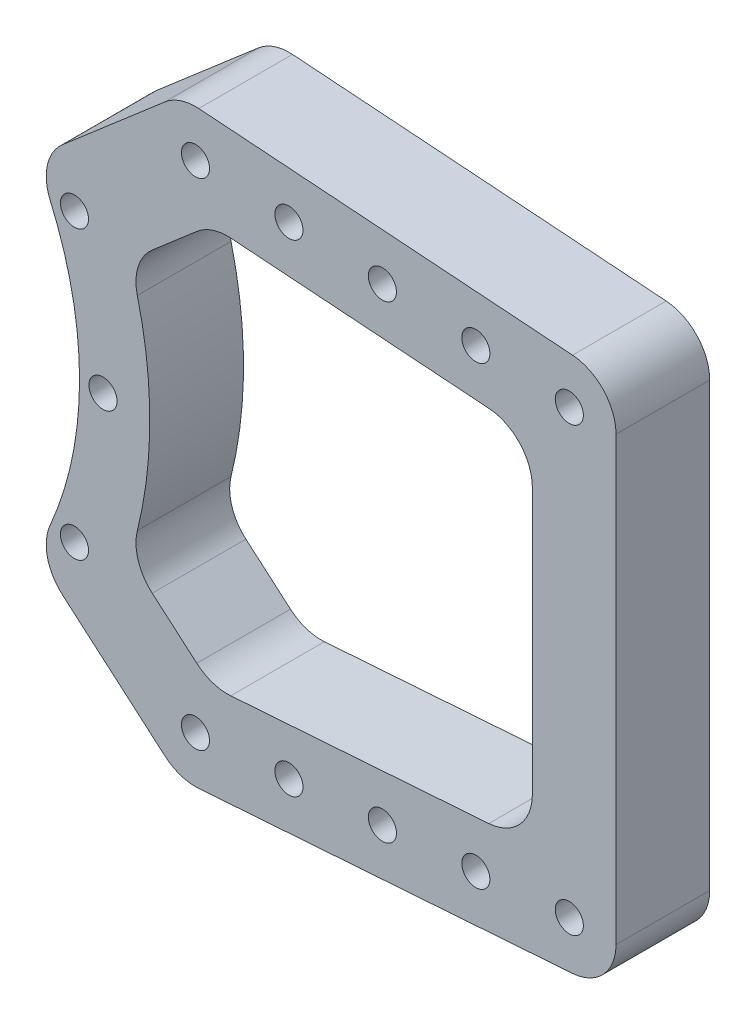
from build123d import *

# Parameters (mm, degrees)
EXTRUDE_1_DEPTH     = 15
FILLET_1_R          = 5
FILLET_2_R          = 5
FILLET_3_R          = 5
FILLET_4_R          = 5
FILLET_5_R          = 5
FILLET_6_R          = 5
FILLET_7_R          = 5
FILLET_8_R          = 5
FILLET_9_R          = 5
FILLET_10_R         = 5
FILLET_11_R         = 5
FILLET_12_R         = 5
FILLET_13_R         = 5
FILLET_14_R         = 5
FILLET_15_R         = 5
FILLET_16_R         = 5
SKETCH_5_R          = 1.5
CUT_EXTRUDE_1_DEPTH = 15
CUT_EXTRUDE_START   = -15
SKETCH_6_R          = 1.5
CUT_EXTRUDE_5_DEPTH = 15
EXTRUDE_2_DEPTH     = 15
FILLET_17_R         = 5
FILLET_18_R         = 5
FILLET_19_R         = 5
FILLET_20_R         = 5
SKETCH_8_W          = 96.520141499
SKETCH_8_H          = 72.316132992
CUT_EXTRUDE_6_DEPTH = 5


with BuildPart() as part:
    # 草图3 → 凸台-拉伸1 (new body)
    with BuildSketch(Plane.XY):
        with BuildLine():
            Line((101.99145665, -27.727634828), (114.18506552, -15.283623844))
            ThreePointArc((114.18506552, -15.283623844), (110, 0), (114.18506552, 15.283623844))
            Line((114.18506552, 15.283623844), (101.99145665, 27.727634828))
            Line((101.99145665, 27.727634828), (48.171786379, 31.57189699))
            Line((48.171786379, 31.57189699), (32.743622368, 18.278544642))
            ThreePointArc((32.743622368, 18.278544642), (37.5, 0), (32.743622368, -18.278544642))
            Line((32.743622368, -18.278544642), (48.171786379, -31.57189699))
            Line((48.171786379, -31.57189699), (101.99145665, -27.727634828))
        make_face()
        with BuildLine():
            ThreePointArc((42.839131819, -13.777110909), (45, 0), (42.839131819, 13.777110909))
            Line((42.839131819, 13.777110909), (51.574083604, 21.303398011))
            Line((51.574083604, 21.303398011), (97.500283316, 18.022955175))
            Line((97.500283316, 18.022955175), (106.212331228, 9.132000819))
            ThreePointArc((106.212331228, 9.132000819), (105, 0), (106.212331228, -9.132000819))
            Line((106.212331228, -9.132000819), (97.500283316, -18.022955175))
            Line((97.500283316, -18.022955175), (51.574083604, -21.303398011))
            Line((51.574083604, -21.303398011), (42.839131819, -13.777110909))
        make_face(mode=Mode.SUBTRACT)
    extrude(amount=EXTRUDE_1_DEPTH)

    # 圆角1
    fillet_1_edges = [part.edges().sort_by_distance(p)[0] for p in [
        (101.99145665, 27.727634828, 7.5),
    ]]
    fillet(fillet_1_edges, radius=FILLET_1_R)

    # 圆角2
    fillet_2_edges = [part.edges().sort_by_distance(p)[0] for p in [
        (114.18506552, 15.283623844, 7.5),
    ]]
    fillet(fillet_2_edges, radius=FILLET_2_R)

    # 圆角3
    fillet_3_edges = [part.edges().sort_by_distance(p)[0] for p in [
        (114.18506552, -15.283623844, 7.5),
    ]]
    fillet(fillet_3_edges, radius=FILLET_3_R)

    # 圆角4
    fillet_4_edges = [part.edges().sort_by_distance(p)[0] for p in [
        (101.99145665, -27.727634828, 7.5),
    ]]
    fillet(fillet_4_edges, radius=FILLET_4_R)

    # 圆角5
    fillet_5_edges = [part.edges().sort_by_distance(p)[0] for p in [
        (48.171786379, -31.57189699, 7.5),
    ]]
    fillet(fillet_5_edges, radius=FILLET_5_R)

    # 圆角6
    fillet_6_edges = [part.edges().sort_by_distance(p)[0] for p in [
        (48.171786379, 31.57189699, 7.5),
    ]]
    fillet(fillet_6_edges, radius=FILLET_6_R)

    # 圆角7
    fillet_7_edges = [part.edges().sort_by_distance(p)[0] for p in [
        (32.743622368, -18.278544642, 7.5),
    ]]
    fillet(fillet_7_edges, radius=FILLET_7_R)

    # 圆角8
    fillet_8_edges = [part.edges().sort_by_distance(p)[0] for p in [
        (32.743622368, 18.278544642, 7.5),
    ]]
    fillet(fillet_8_edges, radius=FILLET_8_R)

    # 圆角9
    fillet_9_edges = [part.edges().sort_by_distance(p)[0] for p in [
        (97.500283316, -18.022955175, 7.5),
    ]]
    fillet(fillet_9_edges, radius=FILLET_9_R)

    # 圆角10
    fillet_10_edges = [part.edges().sort_by_distance(p)[0] for p in [
        (106.212331228, -9.132000819, 7.5),
    ]]
    fillet(fillet_10_edges, radius=FILLET_10_R)

    # 圆角11
    fillet_11_edges = [part.edges().sort_by_distance(p)[0] for p in [
        (106.212331228, 9.132000819, 7.5),
    ]]
    fillet(fillet_11_edges, radius=FILLET_11_R)

    # 圆角12
    fillet_12_edges = [part.edges().sort_by_distance(p)[0] for p in [
        (97.500283316, 18.022955175, 7.5),
    ]]
    fillet(fillet_12_edges, radius=FILLET_12_R)

    # 圆角13
    fillet_13_edges = [part.edges().sort_by_distance(p)[0] for p in [
        (51.574083604, -21.303398011, 7.5),
    ]]
    fillet(fillet_13_edges, radius=FILLET_13_R)

    # 圆角14
    fillet_14_edges = [part.edges().sort_by_distance(p)[0] for p in [
        (42.839131819, -13.777110909, 7.5),
    ]]
    fillet(fillet_14_edges, radius=FILLET_14_R)

    # 圆角15
    fillet_15_edges = [part.edges().sort_by_distance(p)[0] for p in [
        (42.839131819, 13.777110909, 7.5),
    ]]
    fillet(fillet_15_edges, radius=FILLET_15_R)

    # 圆角16
    fillet_16_edges = [part.edges().sort_by_distance(p)[0] for p in [
        (51.574083604, 21.303398011, 7.5),
    ]]
    fillet(fillet_16_edges, radius=FILLET_16_R)

    # 草图5 → 切除-拉伸1 (cut)
    with BuildSketch(Plane(origin=(0, 0, 0), x_dir=(-1, 0, 0), z_dir=(0, 0, -1))):
        with Locations((-36.9551813, 15.307337295)):
            Circle(SKETCH_5_R)
        with Locations((-40, 0)):
            Circle(SKETCH_5_R)
        with Locations((-36.9551813, -15.307337295)):
            Circle(SKETCH_5_R)
        with Locations((-49.872934992, -26.437647501)):
            Circle(SKETCH_5_R)
        with Locations((-49.872934992, 26.437647501)):
            Circle(SKETCH_5_R)
        with Locations((-99.745869983, 22.875295001)):
            Circle(SKETCH_5_R)
        with Locations((-99.745869983, -22.875295001)):
            Circle(SKETCH_5_R)
        with Locations((-109.973915193, 12.437211552)):
            Circle(SKETCH_5_R)
        with Locations((-107.5, 0)):
            Circle(SKETCH_5_R)
        with Locations((-109.973915193, -12.437211552)):
            Circle(SKETCH_5_R)
        with Locations((-59.84752199, 25.725177001)):
            Circle(SKETCH_5_R)
        with Locations((-69.822108988, 25.012706501)):
            Circle(SKETCH_5_R)
        with Locations((-79.796695986, 24.300236001)):
            Circle(SKETCH_5_R)
        with Locations((-89.771282985, 23.587765501)):
            Circle(SKETCH_5_R)
        with Locations((-89.771282985, -23.587765501)):
            Circle(SKETCH_5_R)
        with Locations((-79.796695986, -24.300236001)):
            Circle(SKETCH_5_R)
        with Locations((-69.822108988, -25.012706501)):
            Circle(SKETCH_5_R)
        with Locations((-59.84752199, -25.725177001)):
            Circle(SKETCH_5_R)
    extrude(amount=-CUT_EXTRUDE_1_DEPTH, mode=Mode.SUBTRACT)

    # 草图6 → 切除-拉伸5 (cut)
    # profile 1 of 5: a face of its own
    with BuildSketch(Plane.XY.offset(15).offset(CUT_EXTRUDE_START)):
        with BuildLine():
            ThreePointArc((103.31715251, 26.374715112), (101.845820167, 27.412938577), (100.102105233, 27.8625885))
            Line((100.102105233, 27.8625885), (100.102105233, 24.332379915))
            ThreePointArc((100.102105233, 24.332379915), (100.925775249, 23.801482651), (101.245869983, 22.875295001))
            ThreePointArc((101.245869983, 22.875295001), (100.925775249, 21.949107351), (100.102105233, 21.418210087))
            Line((100.102105233, 21.418210087), (100.102105233, 15.367703489))
            Line((100.102105233, 15.367703489), (104.297377986, 11.086278624))
            ThreePointArc((104.297377986, 11.086278624), (105.514152308, 9.027175008), (105.635333526, 6.638501199))
            ThreePointArc((105.635333526, 6.638501199), (105, 0), (105.635333526, -6.638501199))
            ThreePointArc((105.635333526, -6.638501199), (105.514152308, -9.027175008), (104.297377986, -11.086278624))
            Line((104.297377986, -11.086278624), (100.102105233, -15.367703489))
            Line((100.102105233, -15.367703489), (100.102105233, -21.418210087))
            ThreePointArc((100.102105233, -21.418210087), (100.925775249, -21.949107351), (101.245869983, -22.875295001))
            ThreePointArc((101.245869983, -22.875295001), (100.925775249, -23.801482651), (100.102105233, -24.332379915))
            Line((100.102105233, -24.332379915), (100.102105233, -27.8625885))
            ThreePointArc((100.102105233, -27.8625885), (101.845820167, -27.412938577), (103.31715251, -26.374715112))
            Line((103.31715251, -26.374715112), (111.655402821, -17.865234485))
            ThreePointArc((111.655402821, -17.865234485), (113.00675492, -15.241981218), (112.643531681, -12.313555178))
            ThreePointArc((112.643531681, -12.313555178), (110, 0), (112.643531681, 12.313555178))
            ThreePointArc((112.643531681, 12.313555178), (113.00675492, 15.241981218), (111.655402821, 17.865234485))
            Line((111.655402821, 17.865234485), (103.31715251, 26.374715112))
        make_face()
        with Locations((109.973915193, -12.437211552)):
            Circle(SKETCH_6_R, mode=Mode.SUBTRACT)
        with Locations((107.5, 0)):
            Circle(SKETCH_6_R, mode=Mode.SUBTRACT)
        with Locations((109.973915193, 12.437211552)):
            Circle(SKETCH_6_R, mode=Mode.SUBTRACT)
    # profile 2 of 5: a face of its own
    with BuildSketch(Plane.XY.offset(15).offset(CUT_EXTRUDE_START)):
        with BuildLine():
            Line((100.102105233, -21.418210087), (100.102105233, -15.367703489))
            Line((100.102105233, -15.367703489), (98.825979176, -16.670035459))
            ThreePointArc((98.825979176, -16.670035459), (97.354646834, -17.708258924), (95.610931899, -18.157908847))
            Line((95.610931899, -18.157908847), (94.758576484, -18.218791377))
            Line((94.758576484, -18.218791377), (94.758576484, -23.231530251))
            Line((94.758576484, -23.231530251), (98.249681933, -22.982165576))
            ThreePointArc((98.249681933, -22.982165576), (98.778211836, -21.729154647), (100.102105233, -21.418210087))
        make_face()
    # profile 3 of 5: a face of its own
    with BuildSketch(Plane.XY.offset(15).offset(CUT_EXTRUDE_START)):
        with BuildLine():
            Line((94.758576484, -28.244269125), (100.102105233, -27.8625885))
            Line((100.102105233, -27.8625885), (100.102105233, -24.332379915))
            ThreePointArc((100.102105233, -24.332379915), (98.862330065, -24.087465457), (98.249681933, -22.982165576))
            Line((98.249681933, -22.982165576), (94.758576484, -23.231530251))
            Line((94.758576484, -23.231530251), (94.758576484, -28.244269125))
        make_face()
    # profile 4 of 5: a face of its own
    with BuildSketch(Plane.XY.offset(15).offset(CUT_EXTRUDE_START)):
        with BuildLine():
            Line((100.102105233, 15.367703489), (100.102105233, 21.418210087))
            ThreePointArc((100.102105233, 21.418210087), (98.778211836, 21.729154647), (98.249681933, 22.982165576))
            Line((98.249681933, 22.982165576), (94.758576484, 23.231530251))
            Line((94.758576484, 23.231530251), (94.758576484, 18.218791377))
            Line((94.758576484, 18.218791377), (95.610931899, 18.157908847))
            ThreePointArc((95.610931899, 18.157908847), (97.354646834, 17.708258924), (98.825979176, 16.670035459))
            Line((98.825979176, 16.670035459), (100.102105233, 15.367703489))
        make_face()
    # profile 5 of 5: a face of its own
    with BuildSketch(Plane.XY.offset(15).offset(CUT_EXTRUDE_START)):
        with BuildLine():
            Line((100.102105233, 24.332379915), (100.102105233, 27.8625885))
            Line((100.102105233, 27.8625885), (94.758576484, 28.244269125))
            Line((94.758576484, 28.244269125), (94.758576484, 23.231530251))
            Line((94.758576484, 23.231530251), (98.249681933, 22.982165576))
            ThreePointArc((98.249681933, 22.982165576), (98.862330065, 24.087465457), (100.102105233, 24.332379915))
        make_face()
    extrude(amount=CUT_EXTRUDE_5_DEPTH, mode=Mode.SUBTRACT)

    # 草图7 → 凸台-拉伸2 (add)
    with BuildSketch(Plane.XY.offset(15)):
        Polygon((94.758576484, -18.218791377), (94.758576484, 18.218791377), (85.826771952, 18.856777415), (85.826771952, -18.856777415), align=None)
    extrude(amount=-EXTRUDE_2_DEPTH)

    # 圆角17
    fillet_17_edges = [part.edges().sort_by_distance(p)[0] for p in [
        (94.758576484, 28.244269125, 7.5),
    ]]
    fillet(fillet_17_edges, radius=FILLET_17_R)

    # 圆角18
    fillet_18_edges = [part.edges().sort_by_distance(p)[0] for p in [
        (94.758576484, -28.244269125, 7.5),
    ]]
    fillet(fillet_18_edges, radius=FILLET_18_R)

    # 圆角19
    fillet_19_edges = [part.edges().sort_by_distance(p)[0] for p in [
        (85.826771952, 18.856777415, 7.5),
    ]]
    fillet(fillet_19_edges, radius=FILLET_19_R)

    # 圆角20
    fillet_20_edges = [part.edges().sort_by_distance(p)[0] for p in [
        (85.826771952, -18.856777415, 7.5),
    ]]
    fillet(fillet_20_edges, radius=FILLET_20_R)

    # 草图8 → 切除-拉伸6 (cut)
    with BuildSketch(Plane(origin=(0, 0, 0), x_dir=(-1, 0, 0), z_dir=(0, 0, -1))):
        with Locations((-67.250576804, -3.787424314)):
            Rectangle(SKETCH_8_W, SKETCH_8_H)
    extrude(amount=-CUT_EXTRUDE_6_DEPTH, mode=Mode.SUBTRACT)


solid = part.part
